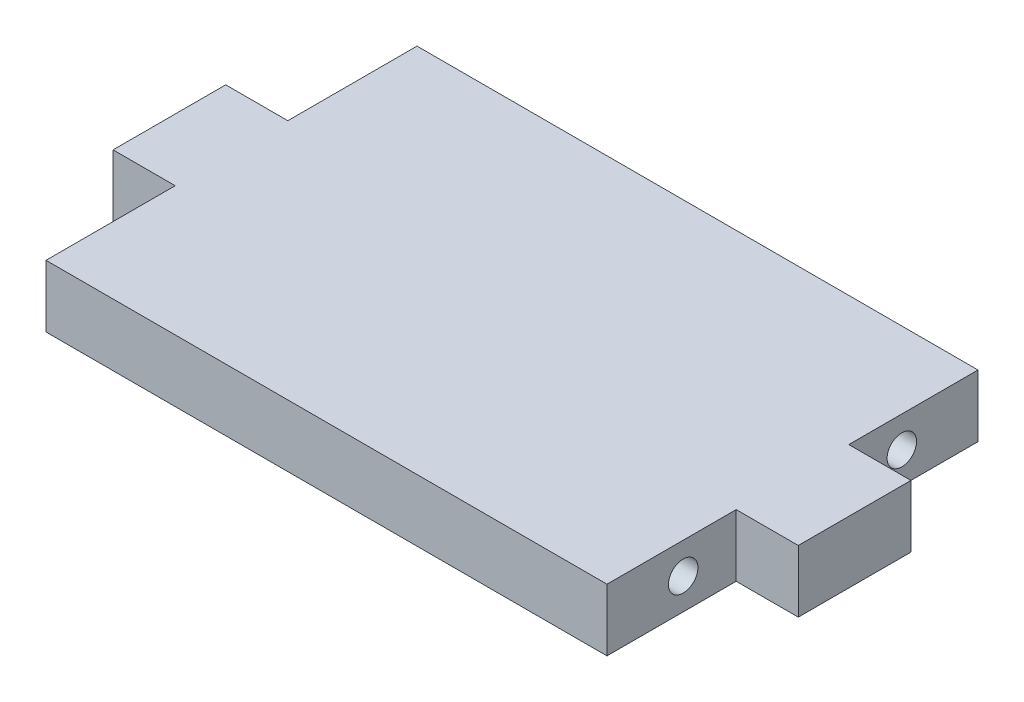
from build123d import *

# Parameters (mm, degrees)
BOSS_EXTRUDE1_DEPTH = 4.7625
SKETCH4_R           = 1.1303
CUT_EXTRUDE1_DEPTH  = 51.076776384


with BuildPart() as part:
    # Sketch3 → Boss-Extrude1 (new body)
    with BuildSketch(Plane(origin=(0, 0, 0), x_dir=(1, 0, 0), z_dir=(0, 1, 0))):
        Polygon((-21.50745, 14.224), (21.50745, 14.224), (21.50745, 4.318), (26.26995, 4.318), (26.26995, -4.318), (21.50745, -4.318), (21.50745, -14.224), (-21.50745, -14.224), (-21.50745, -4.318), (-26.26995, -4.318), (-26.26995, 4.318), (-21.50745, 4.318), align=None)
    extrude(amount=BOSS_EXTRUDE1_DEPTH)

    # Sketch4 → Cut-Extrude1 (cut, through all)
    with BuildSketch(Plane(origin=(21.50745, 0, 0), x_dir=(0, 0, -1), z_dir=(1, 0, 0))):
        with Locations((-8.382, 2.38125)):
            Circle(SKETCH4_R)
        with Locations((8.382, 2.38125)):
            Circle(SKETCH4_R)
    extrude(amount=-CUT_EXTRUDE1_DEPTH, mode=Mode.SUBTRACT)


solid = part.part
